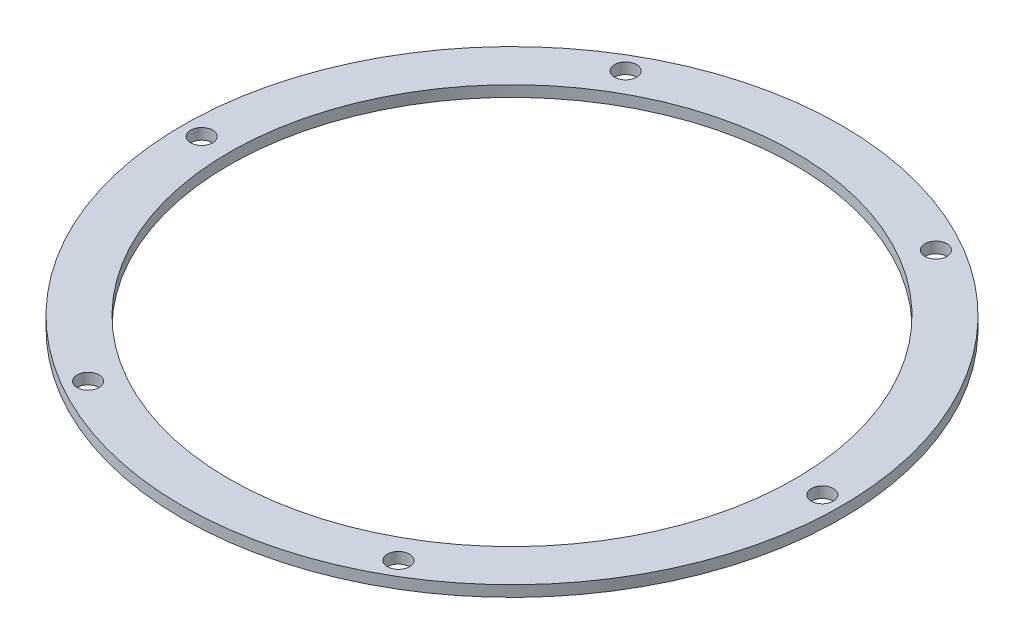
from build123d import *

# Parameters (mm, degrees)
SKETCH_1_R      = 60
SKETCH_1_R_2    = 2
SKETCH_1_R_3    = 51.5
EXTRUDE_1_DEPTH = 2


with BuildPart() as part:
    # 草图1 → 凸台-拉伸1 (new body)
    with BuildSketch(Plane(origin=(0, 0, 0), x_dir=(1, 0, 0), z_dir=(0, 1, 0))):
        with Locations(Location((0, 0, 0), (0, 0, 270))):
            Circle(SKETCH_1_R)
        with Locations(Location((-28.25, 48.930435314, 0), (0, 0, 270))):
            Circle(SKETCH_1_R_2, mode=Mode.SUBTRACT)
        with Locations(Location((28.25, 48.930435314, 0), (0, 0, 270))):
            Circle(SKETCH_1_R_2, mode=Mode.SUBTRACT)
        with Locations(Location((56.5, 0, 0), (0, 0, 270))):
            Circle(SKETCH_1_R_2, mode=Mode.SUBTRACT)
        with Locations(Location((28.25, -48.930435314, 0), (0, 0, 270))):
            Circle(SKETCH_1_R_2, mode=Mode.SUBTRACT)
        with Locations(Location((0, 0, 0), (0, 0, 270))):
            Circle(SKETCH_1_R_3, mode=Mode.SUBTRACT)
        with Locations(Location((-28.25, -48.930435314, 0), (0, 0, 270))):
            Circle(SKETCH_1_R_2, mode=Mode.SUBTRACT)
        with Locations(Location((-56.5, 0, 0), (0, 0, 270))):
            Circle(SKETCH_1_R_2, mode=Mode.SUBTRACT)
    extrude(amount=EXTRUDE_1_DEPTH)


solid = part.part
